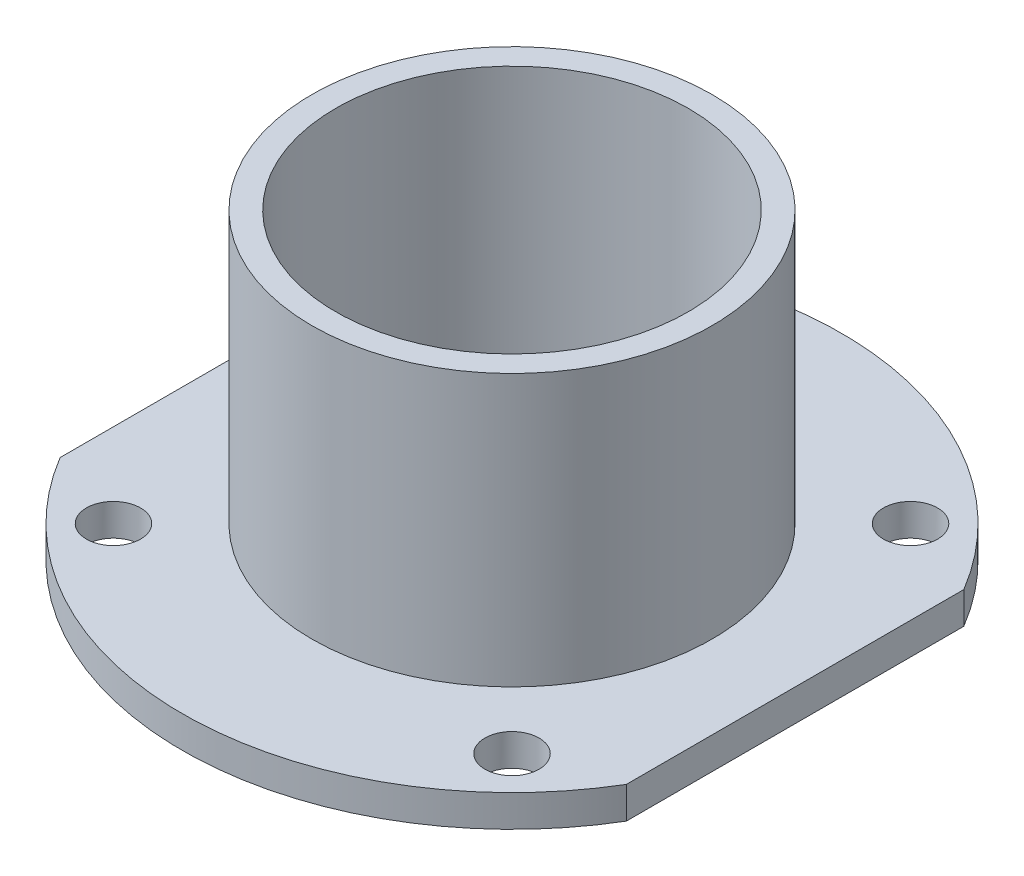
from build123d import *

# Parameters (mm, degrees)
CUT_EXTRUDE2_DEPTH       = 35.926816345
M3_CLEARANCE_HOLE1_D     = 3.4
M3_CLEARANCE_HOLE1_DEPTH = 12.7


with BuildPart() as part:
    # Sketch1 → Revolve1 (revolve)
    with BuildSketch(Plane.XY, mode=Mode.PRIVATE) as revolve1_sk:
        Polygon((12.573, 2), (20.7, 2), (20.7, 0), (11.073, 0), (11.073, 19.05), (12.573, 19.05), align=None)
    revolve(revolve1_sk.sketch.rotate(Axis((0, 0, 0), (0, 1, 0)), 90), axis=Axis((0, 0, 0), (0, 1, 0)))

    # Sketch3 → Cut-Extrude2 (cut, through all)
    with BuildSketch(Plane.XZ):
        with BuildLine():
            Line((-17.78, 10.600075471), (-17.78, -10.600075471))
            ThreePointArc((-17.78, -10.600075471), (-20.7, 0), (-17.78, 10.600075471))
        make_face()
        with BuildLine():
            Line((17.78, -10.600075471), (17.78, 10.600075471))
            ThreePointArc((17.78, 10.600075471), (20.7, 0), (17.78, -10.600075471))
        make_face()
    extrude(amount=-CUT_EXTRUDE2_DEPTH, mode=Mode.SUBTRACT)

    # M3 Clearance Hole1
    with Locations(Plane(origin=(12.515790027, 2, 12.515790027), x_dir=(0, 0, 1), z_dir=(0, 1, 0))):
        with Locations((0, 0), (0, -25.031580054), (-25.031580054, -25.031580054), (-25.031580054, 0)):
            Hole(M3_CLEARANCE_HOLE1_D / 2, depth=M3_CLEARANCE_HOLE1_DEPTH)


solid = part.part
